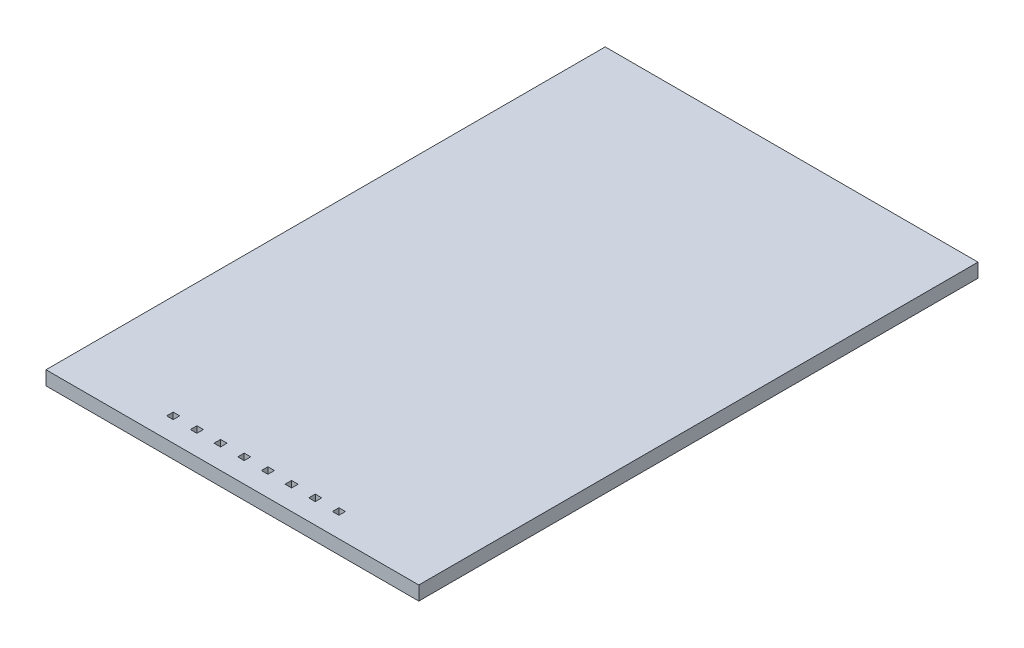
from build123d import *

# Parameters (mm, degrees)
SKETCH_2_W          = 40
SKETCH_2_H          = 60
EXTRUDE_1_DEPTH     = 1.5
SKETCH_3_W          = 0.7
SKETCH_3_H          = 0.7
CUT_EXTRUDE_1_DEPTH = 37.086701152


with BuildPart() as part:
    # Эскиз2 → Бобышка-Вытянуть1 (new body)
    with BuildSketch(Plane(origin=(0, 0, 0), x_dir=(1, 0, 0), z_dir=(0, 1, 0))):
        Rectangle(SKETCH_2_W, SKETCH_2_H)
    extrude(amount=EXTRUDE_1_DEPTH)

    # Эскиз3 → Вырез-Вытянуть1 (cut, through all)
    with BuildSketch(Plane(origin=(0, 1.5, 0), x_dir=(1, 0, 0), z_dir=(0, 1, 0))):
        with Locations((-3.81, -27.46)):
            Rectangle(SKETCH_3_W, SKETCH_3_H)
        with Locations((-1.27, -27.46)):
            Rectangle(SKETCH_3_W, SKETCH_3_H)
        with Locations((-6.35, -27.46)):
            Rectangle(SKETCH_3_W, SKETCH_3_H)
        with Locations((-8.89, -27.46)):
            Rectangle(SKETCH_3_W, SKETCH_3_H)
        with Locations((8.89, -27.46)):
            Rectangle(SKETCH_3_W, SKETCH_3_H)
        with Locations((6.35, -27.46)):
            Rectangle(SKETCH_3_W, SKETCH_3_H)
        with Locations((3.81, -27.46)):
            Rectangle(SKETCH_3_W, SKETCH_3_H)
        with Locations((1.27, -27.46)):
            Rectangle(SKETCH_3_W, SKETCH_3_H)
    extrude(amount=-CUT_EXTRUDE_1_DEPTH, mode=Mode.SUBTRACT)


solid = part.part
